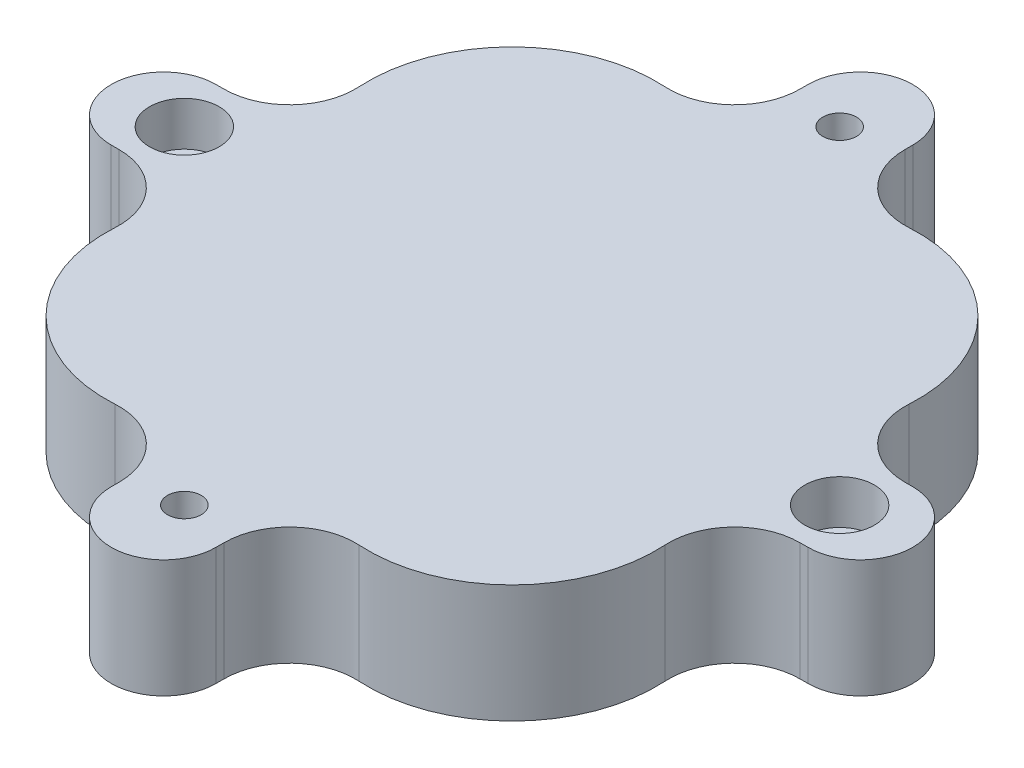
from build123d import *

# Parameters (mm, degrees)
BOSS_EXTRUDE4_DEPTH                                 = 3.81
BOSS_EXTRUDE4_DEPTH_BACK                            = 7.62
CUT_EXTRUDE1_DEPTH                                  = 4.445
CBORE_FOR_4_BINDING_HEAD_MACHINE_SCREW3_D           = 3.2639
CBORE_FOR_4_BINDING_HEAD_MACHINE_SCREW3_CBORE_D     = 6.74624
CBORE_FOR_4_BINDING_HEAD_MACHINE_SCREW3_CBORE_DEPTH = 4.2672
CBORE_FOR_4_BINDING_HEAD_MACHINE_SCREW4_D           = 3.2639
CBORE_FOR_4_BINDING_HEAD_MACHINE_SCREW4_CBORE_D     = 6.74624
CBORE_FOR_4_BINDING_HEAD_MACHINE_SCREW4_CBORE_DEPTH = 4.2672


with BuildPart() as part:
    # Sketch5 → Boss-Extrude4 (new, two sides: drawn at the far end of the back side and taken through both)
    with BuildSketch(Plane(origin=(0, 0, 0), x_dir=(-1, 0, 0), z_dir=(0, -1, 0)).offset(-BOSS_EXTRUDE4_DEPTH_BACK)):
        with BuildLine():
            Line((33.759871133, -5.08), (32.980273667, -5.08))
            ThreePointArc((32.980273667, -5.08), (28.3519556, -7.0824522), (26.642688146, -11.826875))
            ThreePointArc((26.642688146, -11.826875), (22.578281733, -22.578281733), (11.826875, -26.642688146))
            ThreePointArc((11.826875, -26.642688146), (7.0824522, -28.3519556), (5.08, -32.980273667))
            Line((5.08, -32.980273667), (5.08, -33.759871133))
            ThreePointArc((5.08, -33.759871133), (0, -38.839871133), (-5.08, -33.759871133))
            Line((-5.08, -33.759871133), (-5.08, -32.980273667))
            ThreePointArc((-5.08, -32.980273667), (-7.0824522, -28.3519556), (-11.826875, -26.642688146))
            ThreePointArc((-11.826875, -26.642688146), (-22.578281733, -22.578281733), (-26.642688146, -11.826875))
            ThreePointArc((-26.642688146, -11.826875), (-28.3519556, -7.0824522), (-32.980273667, -5.08))
            Line((-32.980273667, -5.08), (-33.759871133, -5.08))
            ThreePointArc((-33.759871133, -5.08), (-38.839871133, 0), (-33.759871133, 5.08))
            Line((-33.759871133, 5.08), (-32.980273667, 5.08))
            ThreePointArc((-32.980273667, 5.08), (-28.3519556, 7.0824522), (-26.642688146, 11.826875))
            ThreePointArc((-26.642688146, 11.826875), (-22.578281733, 22.578281733), (-11.826875, 26.642688146))
            ThreePointArc((-11.826875, 26.642688146), (-7.0824522, 28.3519556), (-5.08, 32.980273667))
            Line((-5.08, 32.980273667), (-5.08, 33.759871133))
            ThreePointArc((-5.08, 33.759871133), (0, 38.839871133), (5.08, 33.759871133))
            Line((5.08, 33.759871133), (5.08, 32.980273667))
            ThreePointArc((5.08, 32.980273667), (7.0824522, 28.3519556), (11.826875, 26.642688146))
            ThreePointArc((11.826875, 26.642688146), (22.578281733, 22.578281733), (26.642688146, 11.826875))
            ThreePointArc((26.642688146, 11.826875), (28.3519556, 7.0824522), (32.980273667, 5.08))
            Line((32.980273667, 5.08), (33.759871133, 5.08))
            ThreePointArc((33.759871133, 5.08), (38.839871133, 0), (33.759871133, -5.08))
        make_face()
    extrude(amount=BOSS_EXTRUDE4_DEPTH + BOSS_EXTRUDE4_DEPTH_BACK)

    # Sketch21 → Cut-Extrude1 (cut)
    with BuildSketch(Plane.XZ.offset(3.81)):
        with BuildLine():
            ThreePointArc((23.473895385, 12.0253125), (20.333217703, 20.333217703), (12.0253125, 23.473895385))
            ThreePointArc((12.0253125, 23.473895385), (11.43, 23.455273667), (10.8346875, 23.473895385))
            Line((10.8346875, 23.473895385), (-10.8346875, 23.473895385))
            ThreePointArc((-10.8346875, 23.473895385), (-11.43, 23.455273667), (-12.0253125, 23.473895385))
            ThreePointArc((-12.0253125, 23.473895385), (-20.333217703, 20.333217703), (-23.473895385, 12.0253125))
            ThreePointArc((-23.473895385, 12.0253125), (-23.455273667, 11.43), (-23.473895385, 10.8346875))
            Line((-23.473895385, 10.8346875), (-23.473895385, -10.8346875))
            ThreePointArc((-23.473895385, -10.8346875), (-23.455273667, -11.43), (-23.473895385, -12.0253125))
            ThreePointArc((-23.473895385, -12.0253125), (-20.333217703, -20.333217703), (-12.0253125, -23.473895385))
            ThreePointArc((-12.0253125, -23.473895385), (-11.43, -23.455273667), (-10.8346875, -23.473895385))
            Line((-10.8346875, -23.473895385), (10.8346875, -23.473895385))
            ThreePointArc((10.8346875, -23.473895385), (11.43, -23.455273667), (12.0253125, -23.473895385))
            ThreePointArc((12.0253125, -23.473895385), (20.333217703, -20.333217703), (23.473895385, -12.0253125))
            ThreePointArc((23.473895385, -12.0253125), (23.455273667, -11.43), (23.473895385, -10.8346875))
            Line((23.473895385, -10.8346875), (23.473895385, 10.8346875))
            ThreePointArc((23.473895385, 10.8346875), (23.455273667, 11.43), (23.473895385, 12.0253125))
        make_face()
    extrude(amount=-CUT_EXTRUDE1_DEPTH, mode=Mode.SUBTRACT)

    # CBORE for #4 Binding Head Machine Screw3 (through all)
    with Locations(Plane(origin=(0, -3.81, 0), x_dir=(-1, 0, 0), z_dir=(0, -1, 0))):
        with Locations((0, 31.75), (0, -31.75)):
            CounterBoreHole(CBORE_FOR_4_BINDING_HEAD_MACHINE_SCREW3_D / 2, CBORE_FOR_4_BINDING_HEAD_MACHINE_SCREW3_CBORE_D / 2, CBORE_FOR_4_BINDING_HEAD_MACHINE_SCREW3_CBORE_DEPTH)

    # CBORE for #4 Binding Head Machine Screw4 (through all)
    with Locations(Plane(origin=(0, 7.62, 0), x_dir=(1, 0, 0), z_dir=(0, 1, 0))):
        with Locations((31.75, 0), (-31.75, 0)):
            CounterBoreHole(CBORE_FOR_4_BINDING_HEAD_MACHINE_SCREW4_D / 2, CBORE_FOR_4_BINDING_HEAD_MACHINE_SCREW4_CBORE_D / 2, CBORE_FOR_4_BINDING_HEAD_MACHINE_SCREW4_CBORE_DEPTH)


solid = part.part
